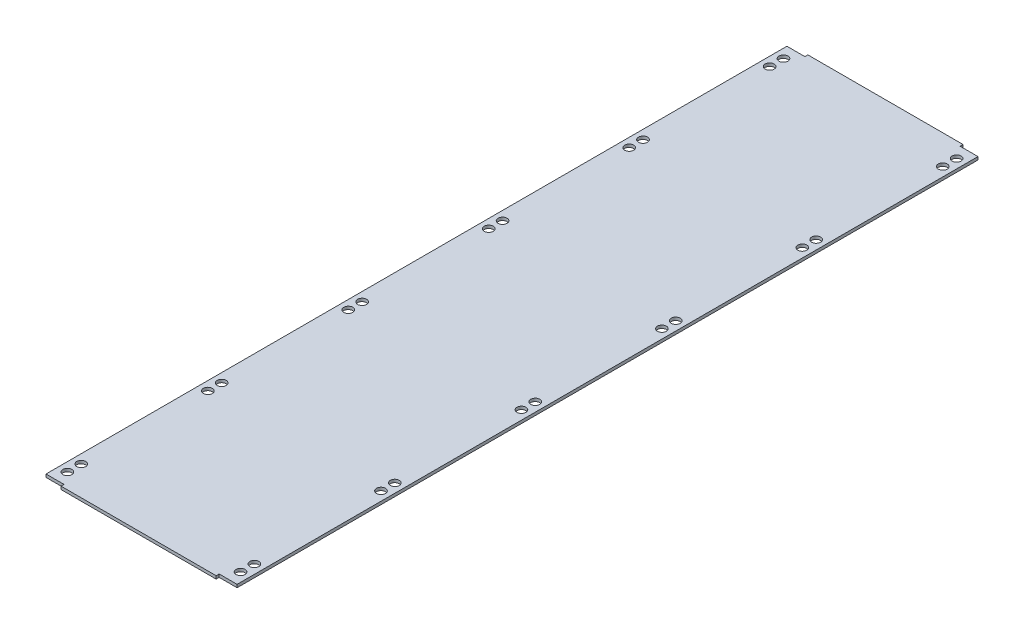
from build123d import *

# Parameters (mm, degrees)
SKETCH1_W           = 83
SKETCH1_H           = 327
BOSS_EXTRUDE1_DEPTH = 1.3
SKETCH2_R           = 1.95
CUT_EXTRUDE1_DEPTH  = 10
SKETCH4_W           = 83
SKETCH4_H           = 2.6
CUT_EXTRUDE2_DEPTH  = 10
SKETCH5_W           = 67.4
SKETCH5_H           = 1.3
BOSS_EXTRUDE2_DEPTH = 1.3


with BuildPart() as part:
    # Sketch1 → Boss-Extrude1 (new body)
    with BuildSketch(Plane(origin=(0, 0, 0), x_dir=(1, 0, 0), z_dir=(0, 1, 0))):
        with Locations((41.5, 163.5)):
            Rectangle(SKETCH1_W, SKETCH1_H)
    extrude(amount=BOSS_EXTRUDE1_DEPTH)

    # Sketch2 → Cut-Extrude1 (cut)
    with BuildSketch(Plane(origin=(0, 1.3, 0), x_dir=(1, 0, 0), z_dir=(0, 1, 0))):
        with Locations(Location((3.9, 319, 0), (0, 0, 270))):
            Circle(SKETCH2_R)
        with Locations(Location((3.9, 313, 0), (0, 0, 270))):
            Circle(SKETCH2_R)
        with Locations(Location((79.1, 319, 0), (0, 0, 270))):
            Circle(SKETCH2_R)
        with Locations(Location((79.1, 313, 0), (0, 0, 270))):
            Circle(SKETCH2_R)
        with Locations(Location((79.1, 258, 0), (0, 0, 270))):
            Circle(SKETCH2_R)
        with Locations(Location((79.1, 252, 0), (0, 0, 270))):
            Circle(SKETCH2_R)
        with Locations(Location((79.1, 197, 0), (0, 0, 270))):
            Circle(SKETCH2_R)
        with Locations(Location((79.1, 191, 0), (0, 0, 270))):
            Circle(SKETCH2_R)
        with Locations(Location((79.1, 136, 0), (0, 0, 270))):
            Circle(SKETCH2_R)
        with Locations(Location((79.1, 130, 0), (0, 0, 270))):
            Circle(SKETCH2_R)
        with Locations(Location((79.1, 75, 0), (0, 0, 270))):
            Circle(SKETCH2_R)
        with Locations(Location((79.1, 69, 0), (0, 0, 270))):
            Circle(SKETCH2_R)
        with Locations(Location((79.1, 14, 0), (0, 0, 270))):
            Circle(SKETCH2_R)
        with Locations(Location((79.1, 8, 0), (0, 0, 270))):
            Circle(SKETCH2_R)
        with Locations(Location((3.9, 258, 0), (0, 0, 270))):
            Circle(SKETCH2_R)
        with Locations(Location((3.9, 252, 0), (0, 0, 270))):
            Circle(SKETCH2_R)
        with Locations(Location((3.9, 197, 0), (0, 0, 270))):
            Circle(SKETCH2_R)
        with Locations(Location((3.9, 191, 0), (0, 0, 270))):
            Circle(SKETCH2_R)
        with Locations(Location((3.9, 136, 0), (0, 0, 270))):
            Circle(SKETCH2_R)
        with Locations(Location((3.9, 130, 0), (0, 0, 270))):
            Circle(SKETCH2_R)
        with Locations(Location((3.9, 75, 0), (0, 0, 270))):
            Circle(SKETCH2_R)
        with Locations(Location((3.9, 69, 0), (0, 0, 270))):
            Circle(SKETCH2_R)
        with Locations(Location((3.9, 14, 0), (0, 0, 270))):
            Circle(SKETCH2_R)
        with Locations(Location((3.9, 8, 0), (0, 0, 270))):
            Circle(SKETCH2_R)
    extrude(amount=-CUT_EXTRUDE1_DEPTH, mode=Mode.SUBTRACT)

    # Sketch4 → Cut-Extrude2 (cut)
    with BuildSketch(Plane(origin=(0, 1.3, 0), x_dir=(1, 0, 0), z_dir=(0, 1, 0))):
        with Locations((41.5, 325.7)):
            Rectangle(SKETCH4_W, SKETCH4_H)
        with Locations((41.5, 1.3)):
            Rectangle(SKETCH4_W, SKETCH4_H)
    extrude(amount=-CUT_EXTRUDE2_DEPTH, mode=Mode.SUBTRACT)

    # Sketch5 → Boss-Extrude2 (add)
    with BuildSketch(Plane(origin=(0, 1.3, 0), x_dir=(1, 0, 0), z_dir=(0, 1, 0))):
        with Locations((41.5, 325.05)):
            Rectangle(SKETCH5_W, SKETCH5_H)
        with Locations((41.5, 1.95)):
            Rectangle(SKETCH5_W, SKETCH5_H)
    extrude(amount=-BOSS_EXTRUDE2_DEPTH)


solid = part.part
